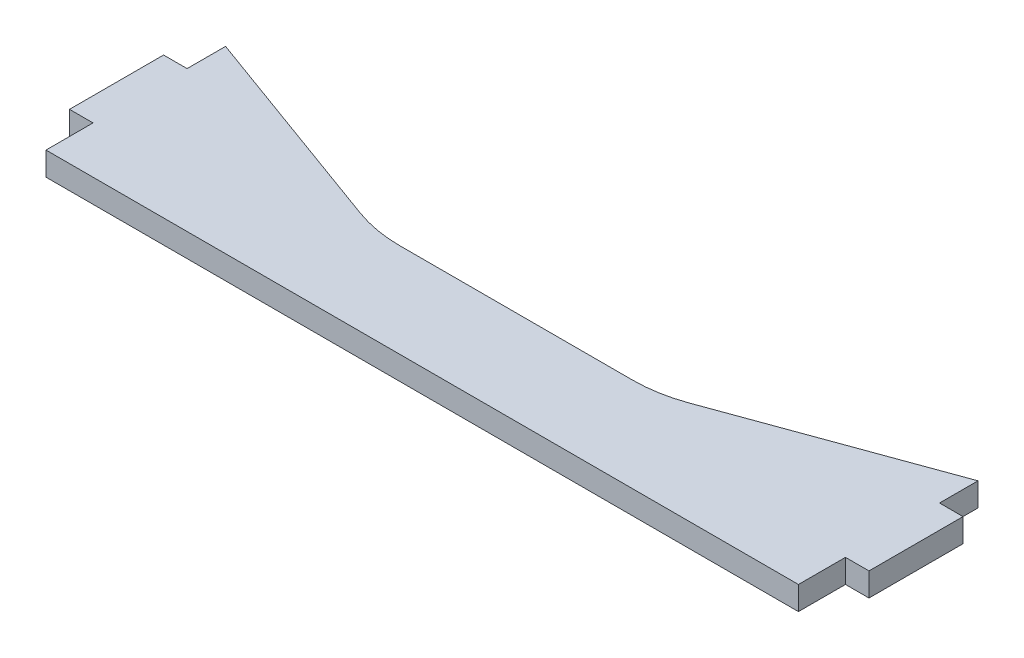
from build123d import *

# Parameters (mm, degrees)
SKETCH_1_W          = 170
SKETCH_1_H          = 20
EXTRUDE_1_DEPTH     = 5
EXTRUDE_2_DEPTH     = 5
FILLET_1_R          = 30
SKETCH_3_W          = 5
SKETCH_3_H          = 10
CUT_EXTRUDE_1_DEPTH = 10


with BuildPart() as part:
    # 스케치1 → 보스-돌출1 (new body)
    with BuildSketch(Plane(origin=(0, 0, 0), x_dir=(1, 0, 0), z_dir=(0, 1, 0))):
        with Locations((85, 10)):
            Rectangle(SKETCH_1_W, SKETCH_1_H)
    extrude(amount=EXTRUDE_1_DEPTH)

    # 스케치2 → 보스-돌출2 (add)
    with BuildSketch(Plane(origin=(0, 5, 0), x_dir=(1, 0, 0), z_dir=(0, 1, 0))):
        Polygon((0, 20), (55, 20), (0, 40), align=None)
        Polygon((115, 20), (170, 20), (170, 40), align=None)
    extrude(amount=-EXTRUDE_2_DEPTH)

    # 필렛1
    fillet_1_edges = [part.edges().sort_by_distance(p)[0] for p in [
        (55, 2.5, -20),
        (115, 2.5, -20),
    ]]
    fillet(fillet_1_edges, radius=FILLET_1_R)

    # 스케치3 → 컷-돌출1 (cut)
    with BuildSketch(Plane.XZ):
        with Locations((167.5, -5)):
            Rectangle(SKETCH_3_W, SKETCH_3_H)
        with Locations((167.5, -35)):
            Rectangle(SKETCH_3_W, SKETCH_3_H)
        with Locations((2.5, -35)):
            Rectangle(SKETCH_3_W, SKETCH_3_H)
        with Locations((2.5, -5)):
            Rectangle(SKETCH_3_W, SKETCH_3_H)
    extrude(amount=-CUT_EXTRUDE_1_DEPTH, mode=Mode.SUBTRACT)


solid = part.part
